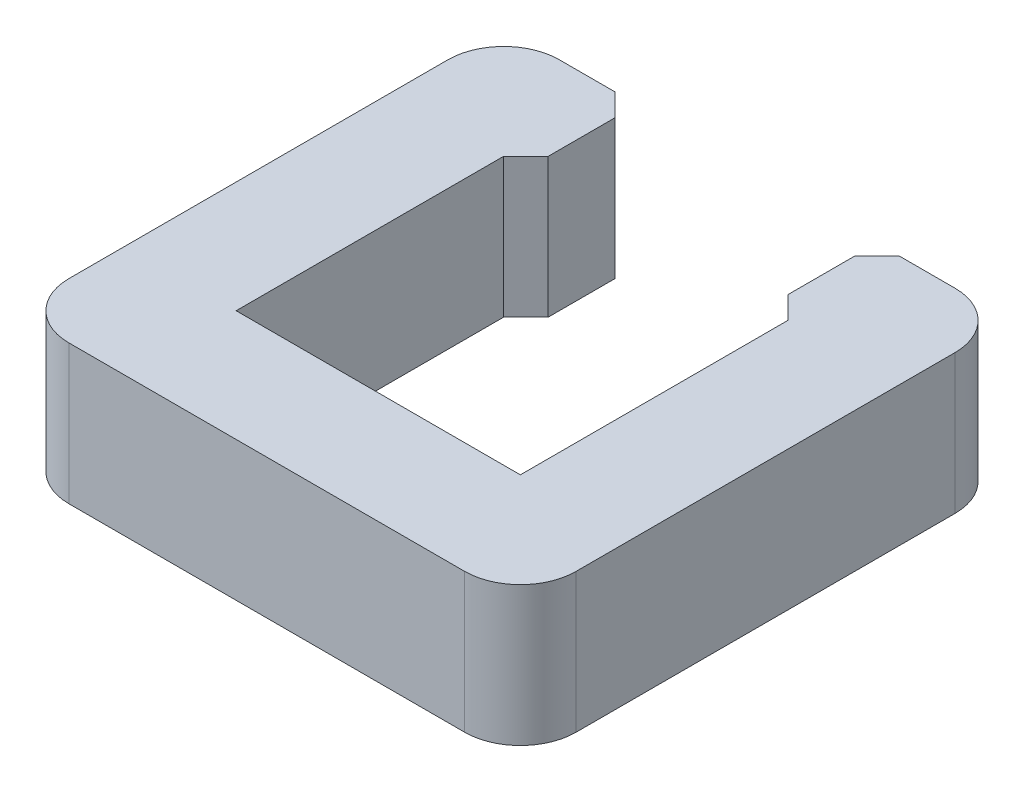
from build123d import *

# Parameters (mm, degrees)
BOSS_EXTRUDE1_DEPTH = 3.175
FILLET1_R           = 1.27


with BuildPart() as part:
    # Sketch1 → Boss-Extrude1 (new body)
    with BuildSketch(Plane(origin=(0, 0, 0), x_dir=(1, 0, 0), z_dir=(0, 1, 0))):
        Polygon((-5.7785, 5.588), (-5.7785, -5.588), (5.7785, -5.588), (5.7785, 5.588), (3.2385, 5.588), (2.7305, 5.08), (2.7305, 3.556), (3.2385, 3.048), (3.2385, -3.048), (-3.2385, -3.048), (-3.2385, 3.048), (-2.7305, 3.556), (-2.7305, 5.08), (-3.2385, 5.588), align=None)
    extrude(amount=BOSS_EXTRUDE1_DEPTH)

    # Fillet1
    fillet1_edges = [part.edges().sort_by_distance(p)[0] for p in [
        (5.7785, 1.5875, -5.588),
        (5.7785, 1.5875, 5.588),
        (-5.7785, 1.5875, 5.588),
        (-5.7785, 1.5875, -5.588),
    ]]
    fillet(fillet1_edges, radius=FILLET1_R)


solid = part.part
